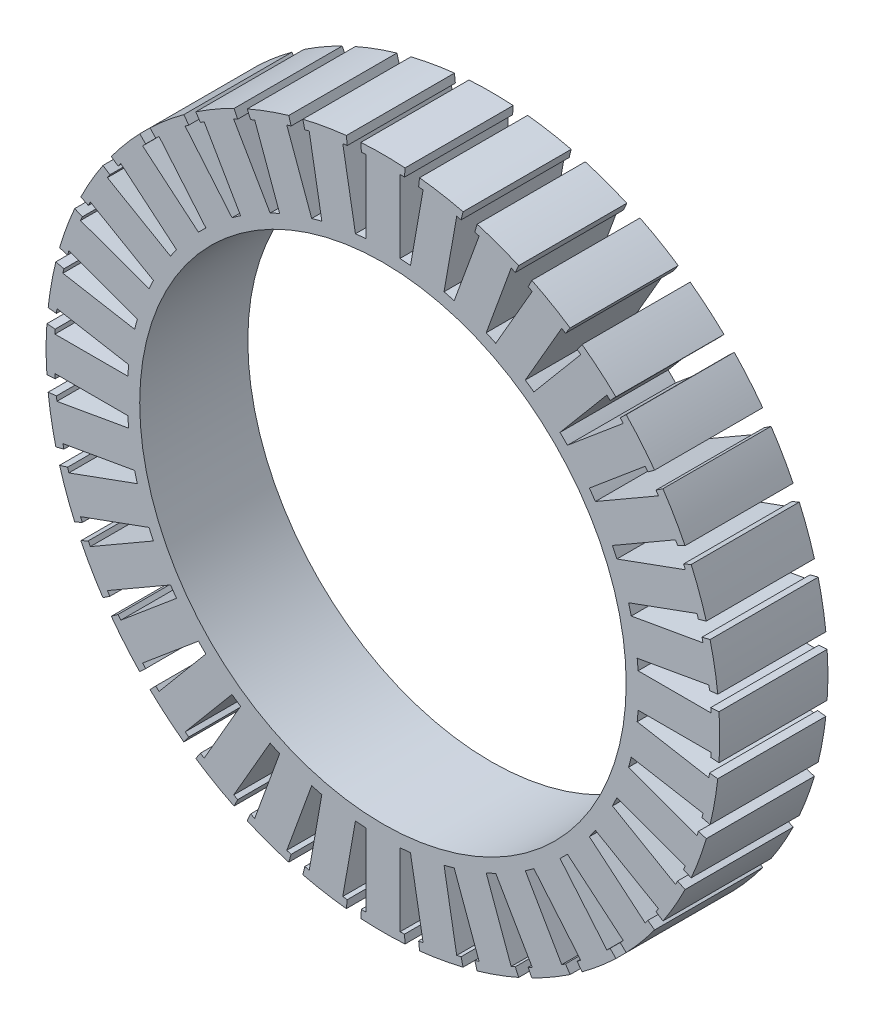
from build123d import *
from build123d.topology import SkipClean

# Parameters (mm, degrees)
BOSS_EXTRUDE2_DEPTH    = 6.5
BOSS_EXTRUDE2_2_DEPTH  = 6.5
BOSS_EXTRUDE2_3_DEPTH  = 6.5
BOSS_EXTRUDE2_4_DEPTH  = 6.5
BOSS_EXTRUDE2_5_DEPTH  = 6.5
BOSS_EXTRUDE2_6_DEPTH  = 6.5
BOSS_EXTRUDE2_7_DEPTH  = 6.5
BOSS_EXTRUDE2_8_DEPTH  = 6.5
BOSS_EXTRUDE2_9_DEPTH  = 6.5
BOSS_EXTRUDE2_10_DEPTH = 6.5
BOSS_EXTRUDE2_11_DEPTH = 6.5
BOSS_EXTRUDE2_12_DEPTH = 6.5
BOSS_EXTRUDE2_13_DEPTH = 6.5
BOSS_EXTRUDE2_14_DEPTH = 6.5
BOSS_EXTRUDE2_15_DEPTH = 6.5
BOSS_EXTRUDE2_16_DEPTH = 6.5
BOSS_EXTRUDE2_17_DEPTH = 6.5
BOSS_EXTRUDE2_18_DEPTH = 6.5
BOSS_EXTRUDE2_19_DEPTH = 6.5
BOSS_EXTRUDE2_20_DEPTH = 6.5
BOSS_EXTRUDE2_21_DEPTH = 6.5
BOSS_EXTRUDE2_22_DEPTH = 6.5
BOSS_EXTRUDE2_23_DEPTH = 6.5
BOSS_EXTRUDE2_24_DEPTH = 6.5
BOSS_EXTRUDE2_25_DEPTH = 6.5
BOSS_EXTRUDE2_26_DEPTH = 6.5
BOSS_EXTRUDE2_27_DEPTH = 6.5
BOSS_EXTRUDE2_28_DEPTH = 6.5
BOSS_EXTRUDE2_29_DEPTH = 6.5
BOSS_EXTRUDE2_30_DEPTH = 6.5
BOSS_EXTRUDE2_31_DEPTH = 6.5
BOSS_EXTRUDE2_32_DEPTH = 6.5
BOSS_EXTRUDE2_33_DEPTH = 6.5
BOSS_EXTRUDE2_34_DEPTH = 6.5
BOSS_EXTRUDE2_35_DEPTH = 6.5
BOSS_EXTRUDE2_36_DEPTH = 6.5
SKETCH2_R              = 30.75
SKETCH2_R_2            = 29.25
BOSS_EXTRUDE3_DEPTH    = 6.5


with BuildPart() as part:
    # Sketch1 → Boss-Extrude2 (new, symmetric)
    with BuildSketch(Plane.XY):
        with BuildLine():
            Line((-2.050835639, 39.446724492), (-2.050835639, 29.178015237))
            ThreePointArc((-2.050835639, 29.178015237), (0, 29.25), (2.050835639, 29.178015237))
            Line((2.050835639, 29.178015237), (2.050835639, 39.446724492))
            ThreePointArc((2.050835639, 39.446724492), (2.321322732, 39.431731648), (2.59170064, 39.41488409))
            Line((2.59170064, 39.41488409), (2.657313314, 40.412729256))
            ThreePointArc((2.657313314, 40.412729256), (0, 40.5), (-2.657313314, 40.412729256))
            Line((-2.657313314, 40.412729256), (-2.59170064, 39.41488409))
            ThreePointArc((-2.59170064, 39.41488409), (-2.321322732, 39.431731648), (-2.050835639, 39.446724492))
        make_face()
    extrude(amount=BOSS_EXTRUDE2_DEPTH, both=True)



with BuildPart() as body_2:
    # Sketch1 → Boss-Extrude2 2 (new, symmetric)
    with BuildSketch(Plane.XY):
        with BuildLine():
            Line((9.634539544, 39.337331478), (9.396649679, 38.366039342))
            ThreePointArc((9.396649679, 38.366039342), (9.133304967, 38.42958158), (8.86953066, 38.49131624))
            Line((8.86953066, 38.49131624), (7.086388011, 28.378611752))
            ThreePointArc((7.086388011, 28.378611752), (5.079209197, 28.805626776), (3.047030337, 29.090859494))
            Line((3.047030337, 29.090859494), (4.830172986, 39.203563982))
            ThreePointArc((4.830172986, 39.203563982), (4.561191719, 39.235768504), (4.291995912, 39.266127529))
            Line((4.291995912, 39.266127529), (4.400654036, 40.260206707))
            ThreePointArc((4.400654036, 40.260206707), (7.032751196, 39.884713997), (9.634539544, 39.337331478))
        make_face()
    extrude(amount=BOSS_EXTRUDE2_2_DEPTH, both=True)


with BuildPart() as body_3:
    # Sketch1 → Boss-Extrude2 3 (new, symmetric)
    with BuildSketch(Plane.XY):
        with BuildLine():
            Line((16.319025165, 37.066688787), (15.916086272, 36.151461904))
            ThreePointArc((15.916086272, 36.151461904), (15.667776352, 36.259768121), (15.418729481, 36.366368821))
            Line((15.418729481, 36.366368821), (11.906624069, 26.716938509))
            ThreePointArc((11.906624069, 26.716938509), (10.004089192, 27.486009158), (8.052313837, 28.119792707))
            Line((8.052313837, 28.119792707), (11.564419249, 37.769223019))
            ThreePointArc((11.564419249, 37.769223019), (11.305116668, 37.847646388), (11.045282339, 37.924289552))
            Line((11.045282339, 37.924289552), (11.32490974, 38.884398149))
            ThreePointArc((11.32490974, 38.884398149), (13.851815805, 38.057551142), (16.319025165, 37.066688787))
        make_face()
    extrude(amount=BOSS_EXTRUDE2_3_DEPTH, both=True)


with BuildPart() as body_4:
    # Sketch1 → Boss-Extrude2 4 (new, symmetric)
    with BuildSketch(Plane.XY):
        with BuildLine():
            Line((22.507665464, 33.669793515), (21.951920638, 32.838440589))
            ThreePointArc((21.951920638, 32.838440589), (21.726190281, 32.988219956), (21.499438008, 33.136447687))
            Line((21.499438008, 33.136447687), (16.365083381, 24.243484608))
            ThreePointArc((16.365083381, 24.243484608), (14.625, 25.331243061), (12.812931857, 26.294320247))
            Line((12.812931857, 26.294320247), (17.947286484, 35.187283326))
            ThreePointArc((17.947286484, 35.187283326), (17.705541368, 35.309542689), (17.462963452, 35.430141229))
            Line((17.462963452, 35.430141229), (17.905063792, 36.327106829))
            ThreePointArc((17.905063792, 36.327106829), (20.25, 35.074028853), (22.507665464, 33.669793515))
        make_face()
    extrude(amount=BOSS_EXTRUDE2_4_DEPTH, both=True)


with BuildPart() as body_5:
    # Sketch1 → Boss-Extrude2 5 (new, symmetric)
    with BuildSketch(Plane.XY):
        with BuildLine():
            Line((28.012421738, 29.249858605), (27.320757003, 28.527639874))
            ThreePointArc((27.320757003, 28.527639874), (27.124464912, 28.714341421), (26.926896991, 28.899692359))
            Line((26.926896991, 28.899692359), (20.326297914, 21.033404696))
            ThreePointArc((20.326297914, 21.033404696), (18.801537583, 22.406799961), (17.184235425, 23.669908172))
            Line((17.184235425, 23.669908172), (23.784834502, 31.536195835))
            ThreePointArc((23.784834502, 31.536195835), (23.567992152, 31.698576402), (23.350041257, 31.859465992))
            Line((23.350041257, 31.859465992), (23.941181542, 32.666034752))
            ThreePointArc((23.941181542, 32.666034752), (26.032898192, 31.024799946), (28.012421738, 29.249858605))
        make_face()
    extrude(amount=BOSS_EXTRUDE2_5_DEPTH, both=True)


with BuildPart() as body_6:
    # Sketch1 → Boss-Extrude2 6 (new, symmetric)
    with BuildSketch(Plane.XY):
        with BuildLine():
            Line((32.666034752, 23.941181542), (31.859465992, 23.350041257))
            ThreePointArc((31.859465992, 23.350041257), (31.698576402, 23.567992152), (31.536195835, 23.784834502))
            Line((31.536195835, 23.784834502), (23.669908172, 17.184235425))
            ThreePointArc((23.669908172, 17.184235425), (22.406799961, 18.801537583), (21.033404696, 20.326297914))
            Line((21.033404696, 20.326297914), (28.899692359, 26.926896991))
            ThreePointArc((28.899692359, 26.926896991), (28.714341421, 27.124464912), (28.527639874, 27.320757003))
            Line((28.527639874, 27.320757003), (29.249858605, 28.012421738))
            ThreePointArc((29.249858605, 28.012421738), (31.024799946, 26.032898192), (32.666034752, 23.941181542))
        make_face()
    extrude(amount=BOSS_EXTRUDE2_6_DEPTH, both=True)


with BuildPart() as body_7:
    # Sketch1 → Boss-Extrude2 7 (new, symmetric)
    with BuildSketch(Plane.XY):
        with BuildLine():
            Line((36.327106829, 17.905063792), (35.430141229, 17.462963452))
            ThreePointArc((35.430141229, 17.462963452), (35.309542689, 17.705541368), (35.187283326, 17.947286484))
            Line((35.187283326, 17.947286484), (26.294320247, 12.812931857))
            ThreePointArc((26.294320247, 12.812931857), (25.331243061, 14.625), (24.243484608, 16.365083381))
            Line((24.243484608, 16.365083381), (33.136447687, 21.499438008))
            ThreePointArc((33.136447687, 21.499438008), (32.988219956, 21.726190281), (32.838440589, 21.951920638))
            Line((32.838440589, 21.951920638), (33.669793515, 22.507665464))
            ThreePointArc((33.669793515, 22.507665464), (35.074028853, 20.25), (36.327106829, 17.905063792))
        make_face()
    extrude(amount=BOSS_EXTRUDE2_7_DEPTH, both=True)


with BuildPart() as body_8:
    # Sketch1 → Boss-Extrude2 8 (new, symmetric)
    with BuildSketch(Plane.XY):
        with BuildLine():
            Line((38.884398149, 11.32490974), (37.924289552, 11.045282339))
            ThreePointArc((37.924289552, 11.045282339), (37.847646388, 11.305116668), (37.769223019, 11.564419249))
            Line((37.769223019, 11.564419249), (28.119792707, 8.052313837))
            ThreePointArc((28.119792707, 8.052313837), (27.486009158, 10.004089192), (26.716938509, 11.906624069))
            Line((26.716938509, 11.906624069), (36.366368821, 15.418729481))
            ThreePointArc((36.366368821, 15.418729481), (36.259768121, 15.667776352), (36.151461904, 15.916086272))
            Line((36.151461904, 15.916086272), (37.066688787, 16.319025165))
            ThreePointArc((37.066688787, 16.319025165), (38.057551142, 13.851815805), (38.884398149, 11.32490974))
        make_face()
    extrude(amount=BOSS_EXTRUDE2_8_DEPTH, both=True)


with BuildPart() as body_9:
    # Sketch1 → Boss-Extrude2 9 (new, symmetric)
    with BuildSketch(Plane.XY):
        with BuildLine():
            Line((40.260206707, 4.400654036), (39.266127529, 4.291995912))
            ThreePointArc((39.266127529, 4.291995912), (39.235768504, 4.561191719), (39.203563982, 4.830172986))
            Line((39.203563982, 4.830172986), (29.090859494, 3.047030337))
            ThreePointArc((29.090859494, 3.047030337), (28.805626776, 5.079209197), (28.378611752, 7.086388011))
            Line((28.378611752, 7.086388011), (38.49131624, 8.86953066))
            ThreePointArc((38.49131624, 8.86953066), (38.42958158, 9.133304967), (38.366039342, 9.396649679))
            Line((38.366039342, 9.396649679), (39.337331478, 9.634539544))
            ThreePointArc((39.337331478, 9.634539544), (39.884713997, 7.032751196), (40.260206707, 4.400654036))
        make_face()
    extrude(amount=BOSS_EXTRUDE2_9_DEPTH, both=True)


with BuildPart() as body_10:
    # Sketch1 → Boss-Extrude2 10 (new, symmetric)
    with BuildSketch(Plane.XY):
        with BuildLine():
            Line((40.412729256, -2.657313314), (39.41488409, -2.59170064))
            ThreePointArc((39.41488409, -2.59170064), (39.431731648, -2.321322732), (39.446724492, -2.050835639))
            Line((39.446724492, -2.050835639), (29.178015237, -2.050835639))
            ThreePointArc((29.178015237, -2.050835639), (29.25, 0), (29.178015237, 2.050835639))
            Line((29.178015237, 2.050835639), (39.446724492, 2.050835639))
            ThreePointArc((39.446724492, 2.050835639), (39.431731648, 2.321322732), (39.41488409, 2.59170064))
            Line((39.41488409, 2.59170064), (40.412729256, 2.657313314))
            ThreePointArc((40.412729256, 2.657313314), (40.5, 0), (40.412729256, -2.657313314))
        make_face()
    extrude(amount=BOSS_EXTRUDE2_10_DEPTH, both=True)


with BuildPart() as body_11:
    # Sketch1 → Boss-Extrude2 11 (new, symmetric)
    with BuildSketch(Plane.XY):
        with BuildLine():
            Line((39.337331478, -9.634539544), (38.366039342, -9.396649679))
            ThreePointArc((38.366039342, -9.396649679), (38.42958158, -9.133304967), (38.49131624, -8.86953066))
            Line((38.49131624, -8.86953066), (28.378611752, -7.086388011))
            ThreePointArc((28.378611752, -7.086388011), (28.805626776, -5.079209197), (29.090859494, -3.047030337))
            Line((29.090859494, -3.047030337), (39.203563982, -4.830172986))
            ThreePointArc((39.203563982, -4.830172986), (39.235768504, -4.561191719), (39.266127529, -4.291995912))
            Line((39.266127529, -4.291995912), (40.260206707, -4.400654036))
            ThreePointArc((40.260206707, -4.400654036), (39.884713997, -7.032751196), (39.337331478, -9.634539544))
        make_face()
    extrude(amount=BOSS_EXTRUDE2_11_DEPTH, both=True)


with BuildPart() as body_12:
    # Sketch1 → Boss-Extrude2 12 (new, symmetric)
    with BuildSketch(Plane.XY):
        with BuildLine():
            Line((37.066688787, -16.319025165), (36.151461904, -15.916086272))
            ThreePointArc((36.151461904, -15.916086272), (36.259768121, -15.667776352), (36.366368821, -15.418729481))
            Line((36.366368821, -15.418729481), (26.716938509, -11.906624069))
            ThreePointArc((26.716938509, -11.906624069), (27.486009158, -10.004089192), (28.119792707, -8.052313837))
            Line((28.119792707, -8.052313837), (37.769223019, -11.564419249))
            ThreePointArc((37.769223019, -11.564419249), (37.847646388, -11.305116668), (37.924289552, -11.045282339))
            Line((37.924289552, -11.045282339), (38.884398149, -11.32490974))
            ThreePointArc((38.884398149, -11.32490974), (38.057551142, -13.851815805), (37.066688787, -16.319025165))
        make_face()
    extrude(amount=BOSS_EXTRUDE2_12_DEPTH, both=True)


with BuildPart() as body_13:
    # Sketch1 → Boss-Extrude2 13 (new, symmetric)
    with BuildSketch(Plane.XY):
        with BuildLine():
            Line((33.669793515, -22.507665464), (32.838440589, -21.951920638))
            ThreePointArc((32.838440589, -21.951920638), (32.988219956, -21.726190281), (33.136447687, -21.499438008))
            Line((33.136447687, -21.499438008), (24.243484608, -16.365083381))
            ThreePointArc((24.243484608, -16.365083381), (25.331243061, -14.625), (26.294320247, -12.812931857))
            Line((26.294320247, -12.812931857), (35.187283326, -17.947286484))
            ThreePointArc((35.187283326, -17.947286484), (35.309542689, -17.705541368), (35.430141229, -17.462963452))
            Line((35.430141229, -17.462963452), (36.327106829, -17.905063792))
            ThreePointArc((36.327106829, -17.905063792), (35.074028853, -20.25), (33.669793515, -22.507665464))
        make_face()
    extrude(amount=BOSS_EXTRUDE2_13_DEPTH, both=True)


with BuildPart() as body_14:
    # Sketch1 → Boss-Extrude2 14 (new, symmetric)
    with BuildSketch(Plane.XY):
        with BuildLine():
            Line((29.249858605, -28.012421738), (28.527639874, -27.320757003))
            ThreePointArc((28.527639874, -27.320757003), (28.714341421, -27.124464912), (28.899692359, -26.926896991))
            Line((28.899692359, -26.926896991), (21.033404696, -20.326297914))
            ThreePointArc((21.033404696, -20.326297914), (22.406799961, -18.801537583), (23.669908172, -17.184235425))
            Line((23.669908172, -17.184235425), (31.536195835, -23.784834502))
            ThreePointArc((31.536195835, -23.784834502), (31.698576402, -23.567992152), (31.859465992, -23.350041257))
            Line((31.859465992, -23.350041257), (32.666034752, -23.941181542))
            ThreePointArc((32.666034752, -23.941181542), (31.024799946, -26.032898192), (29.249858605, -28.012421738))
        make_face()
    extrude(amount=BOSS_EXTRUDE2_14_DEPTH, both=True)


with BuildPart() as body_15:
    # Sketch1 → Boss-Extrude2 15 (new, symmetric)
    with BuildSketch(Plane.XY):
        with BuildLine():
            Line((23.941181542, -32.666034752), (23.350041257, -31.859465992))
            ThreePointArc((23.350041257, -31.859465992), (23.567992152, -31.698576402), (23.784834502, -31.536195835))
            Line((23.784834502, -31.536195835), (17.184235425, -23.669908172))
            ThreePointArc((17.184235425, -23.669908172), (18.801537583, -22.406799961), (20.326297914, -21.033404696))
            Line((20.326297914, -21.033404696), (26.926896991, -28.899692359))
            ThreePointArc((26.926896991, -28.899692359), (27.124464912, -28.714341421), (27.320757003, -28.527639874))
            Line((27.320757003, -28.527639874), (28.012421738, -29.249858605))
            ThreePointArc((28.012421738, -29.249858605), (26.032898192, -31.024799946), (23.941181542, -32.666034752))
        make_face()
    extrude(amount=BOSS_EXTRUDE2_15_DEPTH, both=True)


with BuildPart() as body_16:
    # Sketch1 → Boss-Extrude2 16 (new, symmetric)
    with BuildSketch(Plane.XY):
        with BuildLine():
            Line((17.905063792, -36.327106829), (17.462963452, -35.430141229))
            ThreePointArc((17.462963452, -35.430141229), (17.705541368, -35.309542689), (17.947286484, -35.187283326))
            Line((17.947286484, -35.187283326), (12.812931857, -26.294320247))
            ThreePointArc((12.812931857, -26.294320247), (14.625, -25.331243061), (16.365083381, -24.243484608))
            Line((16.365083381, -24.243484608), (21.499438008, -33.136447687))
            ThreePointArc((21.499438008, -33.136447687), (21.726190281, -32.988219956), (21.951920638, -32.838440589))
            Line((21.951920638, -32.838440589), (22.507665464, -33.669793515))
            ThreePointArc((22.507665464, -33.669793515), (20.25, -35.074028853), (17.905063792, -36.327106829))
        make_face()
    extrude(amount=BOSS_EXTRUDE2_16_DEPTH, both=True)


with BuildPart() as body_17:
    # Sketch1 → Boss-Extrude2 17 (new, symmetric)
    with BuildSketch(Plane.XY):
        with BuildLine():
            Line((11.32490974, -38.884398149), (11.045282339, -37.924289552))
            ThreePointArc((11.045282339, -37.924289552), (11.305116668, -37.847646388), (11.564419249, -37.769223019))
            Line((11.564419249, -37.769223019), (8.052313837, -28.119792707))
            ThreePointArc((8.052313837, -28.119792707), (10.004089192, -27.486009158), (11.906624069, -26.716938509))
            Line((11.906624069, -26.716938509), (15.418729481, -36.366368821))
            ThreePointArc((15.418729481, -36.366368821), (15.667776352, -36.259768121), (15.916086272, -36.151461904))
            Line((15.916086272, -36.151461904), (16.319025165, -37.066688787))
            ThreePointArc((16.319025165, -37.066688787), (13.851815805, -38.057551142), (11.32490974, -38.884398149))
        make_face()
    extrude(amount=BOSS_EXTRUDE2_17_DEPTH, both=True)


with BuildPart() as body_18:
    # Sketch1 → Boss-Extrude2 18 (new, symmetric)
    with BuildSketch(Plane.XY):
        with BuildLine():
            Line((4.400654036, -40.260206707), (4.291995912, -39.266127529))
            ThreePointArc((4.291995912, -39.266127529), (4.561191719, -39.235768504), (4.830172986, -39.203563982))
            Line((4.830172986, -39.203563982), (3.047030337, -29.090859494))
            ThreePointArc((3.047030337, -29.090859494), (5.079209197, -28.805626776), (7.086388011, -28.378611752))
            Line((7.086388011, -28.378611752), (8.86953066, -38.49131624))
            ThreePointArc((8.86953066, -38.49131624), (9.133304967, -38.42958158), (9.396649679, -38.366039342))
            Line((9.396649679, -38.366039342), (9.634539544, -39.337331478))
            ThreePointArc((9.634539544, -39.337331478), (7.032751196, -39.884713997), (4.400654036, -40.260206707))
        make_face()
    extrude(amount=BOSS_EXTRUDE2_18_DEPTH, both=True)


with BuildPart() as body_19:
    # Sketch1 → Boss-Extrude2 19 (new, symmetric)
    with BuildSketch(Plane.XY):
        with BuildLine():
            Line((-2.657313314, -40.412729256), (-2.59170064, -39.41488409))
            ThreePointArc((-2.59170064, -39.41488409), (-2.321322732, -39.431731648), (-2.050835639, -39.446724492))
            Line((-2.050835639, -39.446724492), (-2.050835639, -29.178015237))
            ThreePointArc((-2.050835639, -29.178015237), (0, -29.25), (2.050835639, -29.178015237))
            Line((2.050835639, -29.178015237), (2.050835639, -39.446724492))
            ThreePointArc((2.050835639, -39.446724492), (2.321322732, -39.431731648), (2.59170064, -39.41488409))
            Line((2.59170064, -39.41488409), (2.657313314, -40.412729256))
            ThreePointArc((2.657313314, -40.412729256), (0, -40.5), (-2.657313314, -40.412729256))
        make_face()
    extrude(amount=BOSS_EXTRUDE2_19_DEPTH, both=True)


with BuildPart() as body_20:
    # Sketch1 → Boss-Extrude2 20 (new, symmetric)
    with BuildSketch(Plane.XY):
        with BuildLine():
            Line((-9.634539544, -39.337331478), (-9.396649679, -38.366039342))
            ThreePointArc((-9.396649679, -38.366039342), (-9.133304967, -38.42958158), (-8.86953066, -38.49131624))
            Line((-8.86953066, -38.49131624), (-7.086388011, -28.378611752))
            ThreePointArc((-7.086388011, -28.378611752), (-5.079209197, -28.805626776), (-3.047030337, -29.090859494))
            Line((-3.047030337, -29.090859494), (-4.830172986, -39.203563982))
            ThreePointArc((-4.830172986, -39.203563982), (-4.561191719, -39.235768504), (-4.291995912, -39.266127529))
            Line((-4.291995912, -39.266127529), (-4.400654036, -40.260206707))
            ThreePointArc((-4.400654036, -40.260206707), (-7.032751196, -39.884713997), (-9.634539544, -39.337331478))
        make_face()
    extrude(amount=BOSS_EXTRUDE2_20_DEPTH, both=True)


with BuildPart() as body_21:
    # Sketch1 → Boss-Extrude2 21 (new, symmetric)
    with BuildSketch(Plane.XY):
        with BuildLine():
            Line((-16.319025165, -37.066688787), (-15.916086272, -36.151461904))
            ThreePointArc((-15.916086272, -36.151461904), (-15.667776352, -36.259768121), (-15.418729481, -36.366368821))
            Line((-15.418729481, -36.366368821), (-11.906624069, -26.716938509))
            ThreePointArc((-11.906624069, -26.716938509), (-10.004089192, -27.486009158), (-8.052313837, -28.119792707))
            Line((-8.052313837, -28.119792707), (-11.564419249, -37.769223019))
            ThreePointArc((-11.564419249, -37.769223019), (-11.305116668, -37.847646388), (-11.045282339, -37.924289552))
            Line((-11.045282339, -37.924289552), (-11.32490974, -38.884398149))
            ThreePointArc((-11.32490974, -38.884398149), (-13.851815805, -38.057551142), (-16.319025165, -37.066688787))
        make_face()
    extrude(amount=BOSS_EXTRUDE2_21_DEPTH, both=True)


with BuildPart() as body_22:
    # Sketch1 → Boss-Extrude2 22 (new, symmetric)
    with BuildSketch(Plane.XY):
        with BuildLine():
            Line((-22.507665464, -33.669793515), (-21.951920638, -32.838440589))
            ThreePointArc((-21.951920638, -32.838440589), (-21.726190281, -32.988219956), (-21.499438008, -33.136447687))
            Line((-21.499438008, -33.136447687), (-16.365083381, -24.243484608))
            ThreePointArc((-16.365083381, -24.243484608), (-14.625, -25.331243061), (-12.812931857, -26.294320247))
            Line((-12.812931857, -26.294320247), (-17.947286484, -35.187283326))
            ThreePointArc((-17.947286484, -35.187283326), (-17.705541368, -35.309542689), (-17.462963452, -35.430141229))
            Line((-17.462963452, -35.430141229), (-17.905063792, -36.327106829))
            ThreePointArc((-17.905063792, -36.327106829), (-20.25, -35.074028853), (-22.507665464, -33.669793515))
        make_face()
    extrude(amount=BOSS_EXTRUDE2_22_DEPTH, both=True)


with BuildPart() as body_23:
    # Sketch1 → Boss-Extrude2 23 (new, symmetric)
    with BuildSketch(Plane.XY):
        with BuildLine():
            Line((-28.012421738, -29.249858605), (-27.320757003, -28.527639874))
            ThreePointArc((-27.320757003, -28.527639874), (-27.124464912, -28.714341421), (-26.926896991, -28.899692359))
            Line((-26.926896991, -28.899692359), (-20.326297914, -21.033404696))
            ThreePointArc((-20.326297914, -21.033404696), (-18.801537583, -22.406799961), (-17.184235425, -23.669908172))
            Line((-17.184235425, -23.669908172), (-23.784834502, -31.536195835))
            ThreePointArc((-23.784834502, -31.536195835), (-23.567992152, -31.698576402), (-23.350041257, -31.859465992))
            Line((-23.350041257, -31.859465992), (-23.941181542, -32.666034752))
            ThreePointArc((-23.941181542, -32.666034752), (-26.032898192, -31.024799946), (-28.012421738, -29.249858605))
        make_face()
    extrude(amount=BOSS_EXTRUDE2_23_DEPTH, both=True)


with BuildPart() as body_24:
    # Sketch1 → Boss-Extrude2 24 (new, symmetric)
    with BuildSketch(Plane.XY):
        with BuildLine():
            Line((-32.666034752, -23.941181542), (-31.859465992, -23.350041257))
            ThreePointArc((-31.859465992, -23.350041257), (-31.698576402, -23.567992152), (-31.536195835, -23.784834502))
            Line((-31.536195835, -23.784834502), (-23.669908172, -17.184235425))
            ThreePointArc((-23.669908172, -17.184235425), (-22.406799961, -18.801537583), (-21.033404696, -20.326297914))
            Line((-21.033404696, -20.326297914), (-28.899692359, -26.926896991))
            ThreePointArc((-28.899692359, -26.926896991), (-28.714341421, -27.124464912), (-28.527639874, -27.320757003))
            Line((-28.527639874, -27.320757003), (-29.249858605, -28.012421738))
            ThreePointArc((-29.249858605, -28.012421738), (-31.024799946, -26.032898192), (-32.666034752, -23.941181542))
        make_face()
    extrude(amount=BOSS_EXTRUDE2_24_DEPTH, both=True)


with BuildPart() as body_25:
    # Sketch1 → Boss-Extrude2 25 (new, symmetric)
    with BuildSketch(Plane.XY):
        with BuildLine():
            Line((-36.327106829, -17.905063792), (-35.430141229, -17.462963452))
            ThreePointArc((-35.430141229, -17.462963452), (-35.309542689, -17.705541368), (-35.187283326, -17.947286484))
            Line((-35.187283326, -17.947286484), (-26.294320247, -12.812931857))
            ThreePointArc((-26.294320247, -12.812931857), (-25.331243061, -14.625), (-24.243484608, -16.365083381))
            Line((-24.243484608, -16.365083381), (-33.136447687, -21.499438008))
            ThreePointArc((-33.136447687, -21.499438008), (-32.988219956, -21.726190281), (-32.838440589, -21.951920638))
            Line((-32.838440589, -21.951920638), (-33.669793515, -22.507665464))
            ThreePointArc((-33.669793515, -22.507665464), (-35.074028853, -20.25), (-36.327106829, -17.905063792))
        make_face()
    extrude(amount=BOSS_EXTRUDE2_25_DEPTH, both=True)


with BuildPart() as body_26:
    # Sketch1 → Boss-Extrude2 26 (new, symmetric)
    with BuildSketch(Plane.XY):
        with BuildLine():
            Line((-38.884398149, -11.32490974), (-37.924289552, -11.045282339))
            ThreePointArc((-37.924289552, -11.045282339), (-37.847646388, -11.305116668), (-37.769223019, -11.564419249))
            Line((-37.769223019, -11.564419249), (-28.119792707, -8.052313837))
            ThreePointArc((-28.119792707, -8.052313837), (-27.486009158, -10.004089192), (-26.716938509, -11.906624069))
            Line((-26.716938509, -11.906624069), (-36.366368821, -15.418729481))
            ThreePointArc((-36.366368821, -15.418729481), (-36.259768121, -15.667776352), (-36.151461904, -15.916086272))
            Line((-36.151461904, -15.916086272), (-37.066688787, -16.319025165))
            ThreePointArc((-37.066688787, -16.319025165), (-38.057551142, -13.851815805), (-38.884398149, -11.32490974))
        make_face()
    extrude(amount=BOSS_EXTRUDE2_26_DEPTH, both=True)


with BuildPart() as body_27:
    # Sketch1 → Boss-Extrude2 27 (new, symmetric)
    with BuildSketch(Plane.XY):
        with BuildLine():
            Line((-40.260206707, -4.400654036), (-39.266127529, -4.291995912))
            ThreePointArc((-39.266127529, -4.291995912), (-39.235768504, -4.561191719), (-39.203563982, -4.830172986))
            Line((-39.203563982, -4.830172986), (-29.090859494, -3.047030337))
            ThreePointArc((-29.090859494, -3.047030337), (-28.805626776, -5.079209197), (-28.378611752, -7.086388011))
            Line((-28.378611752, -7.086388011), (-38.49131624, -8.86953066))
            ThreePointArc((-38.49131624, -8.86953066), (-38.42958158, -9.133304967), (-38.366039342, -9.396649679))
            Line((-38.366039342, -9.396649679), (-39.337331478, -9.634539544))
            ThreePointArc((-39.337331478, -9.634539544), (-39.884713997, -7.032751196), (-40.260206707, -4.400654036))
        make_face()
    extrude(amount=BOSS_EXTRUDE2_27_DEPTH, both=True)


with BuildPart() as body_28:
    # Sketch1 → Boss-Extrude2 28 (new, symmetric)
    with BuildSketch(Plane.XY):
        with BuildLine():
            Line((-40.412729256, 2.657313314), (-39.41488409, 2.59170064))
            ThreePointArc((-39.41488409, 2.59170064), (-39.431731648, 2.321322732), (-39.446724492, 2.050835639))
            Line((-39.446724492, 2.050835639), (-29.178015237, 2.050835639))
            ThreePointArc((-29.178015237, 2.050835639), (-29.25, 0), (-29.178015237, -2.050835639))
            Line((-29.178015237, -2.050835639), (-39.446724492, -2.050835639))
            ThreePointArc((-39.446724492, -2.050835639), (-39.431731648, -2.321322732), (-39.41488409, -2.59170064))
            Line((-39.41488409, -2.59170064), (-40.412729256, -2.657313314))
            ThreePointArc((-40.412729256, -2.657313314), (-40.5, 0), (-40.412729256, 2.657313314))
        make_face()
    extrude(amount=BOSS_EXTRUDE2_28_DEPTH, both=True)


with BuildPart() as body_29:
    # Sketch1 → Boss-Extrude2 29 (new, symmetric)
    with BuildSketch(Plane.XY):
        with BuildLine():
            Line((-39.337331478, 9.634539544), (-38.366039342, 9.396649679))
            ThreePointArc((-38.366039342, 9.396649679), (-38.42958158, 9.133304967), (-38.49131624, 8.86953066))
            Line((-38.49131624, 8.86953066), (-28.378611752, 7.086388011))
            ThreePointArc((-28.378611752, 7.086388011), (-28.805626776, 5.079209197), (-29.090859494, 3.047030337))
            Line((-29.090859494, 3.047030337), (-39.203563982, 4.830172986))
            ThreePointArc((-39.203563982, 4.830172986), (-39.235768504, 4.561191719), (-39.266127529, 4.291995912))
            Line((-39.266127529, 4.291995912), (-40.260206707, 4.400654036))
            ThreePointArc((-40.260206707, 4.400654036), (-39.884713997, 7.032751196), (-39.337331478, 9.634539544))
        make_face()
    extrude(amount=BOSS_EXTRUDE2_29_DEPTH, both=True)


with BuildPart() as body_30:
    # Sketch1 → Boss-Extrude2 30 (new, symmetric)
    with BuildSketch(Plane.XY):
        with BuildLine():
            Line((-37.066688787, 16.319025165), (-36.151461904, 15.916086272))
            ThreePointArc((-36.151461904, 15.916086272), (-36.259768121, 15.667776352), (-36.366368821, 15.418729481))
            Line((-36.366368821, 15.418729481), (-26.716938509, 11.906624069))
            ThreePointArc((-26.716938509, 11.906624069), (-27.486009158, 10.004089192), (-28.119792707, 8.052313837))
            Line((-28.119792707, 8.052313837), (-37.769223019, 11.564419249))
            ThreePointArc((-37.769223019, 11.564419249), (-37.847646388, 11.305116668), (-37.924289552, 11.045282339))
            Line((-37.924289552, 11.045282339), (-38.884398149, 11.32490974))
            ThreePointArc((-38.884398149, 11.32490974), (-38.057551142, 13.851815805), (-37.066688787, 16.319025165))
        make_face()
    extrude(amount=BOSS_EXTRUDE2_30_DEPTH, both=True)


with BuildPart() as body_31:
    # Sketch1 → Boss-Extrude2 31 (new, symmetric)
    with BuildSketch(Plane.XY):
        with BuildLine():
            Line((-33.669793515, 22.507665464), (-32.838440589, 21.951920638))
            ThreePointArc((-32.838440589, 21.951920638), (-32.988219956, 21.726190281), (-33.136447687, 21.499438008))
            Line((-33.136447687, 21.499438008), (-24.243484608, 16.365083381))
            ThreePointArc((-24.243484608, 16.365083381), (-25.331243061, 14.625), (-26.294320247, 12.812931857))
            Line((-26.294320247, 12.812931857), (-35.187283326, 17.947286484))
            ThreePointArc((-35.187283326, 17.947286484), (-35.309542689, 17.705541368), (-35.430141229, 17.462963452))
            Line((-35.430141229, 17.462963452), (-36.327106829, 17.905063792))
            ThreePointArc((-36.327106829, 17.905063792), (-35.074028853, 20.25), (-33.669793515, 22.507665464))
        make_face()
    extrude(amount=BOSS_EXTRUDE2_31_DEPTH, both=True)


with BuildPart() as body_32:
    # Sketch1 → Boss-Extrude2 32 (new, symmetric)
    with BuildSketch(Plane.XY):
        with BuildLine():
            Line((-29.249858605, 28.012421738), (-28.527639874, 27.320757003))
            ThreePointArc((-28.527639874, 27.320757003), (-28.714341421, 27.124464912), (-28.899692359, 26.926896991))
            Line((-28.899692359, 26.926896991), (-21.033404696, 20.326297914))
            ThreePointArc((-21.033404696, 20.326297914), (-22.406799961, 18.801537583), (-23.669908172, 17.184235425))
            Line((-23.669908172, 17.184235425), (-31.536195835, 23.784834502))
            ThreePointArc((-31.536195835, 23.784834502), (-31.698576402, 23.567992152), (-31.859465992, 23.350041257))
            Line((-31.859465992, 23.350041257), (-32.666034752, 23.941181542))
            ThreePointArc((-32.666034752, 23.941181542), (-31.024799946, 26.032898192), (-29.249858605, 28.012421738))
        make_face()
    extrude(amount=BOSS_EXTRUDE2_32_DEPTH, both=True)


with BuildPart() as body_33:
    # Sketch1 → Boss-Extrude2 33 (new, symmetric)
    with BuildSketch(Plane.XY):
        with BuildLine():
            Line((-23.941181542, 32.666034752), (-23.350041257, 31.859465992))
            ThreePointArc((-23.350041257, 31.859465992), (-23.567992152, 31.698576402), (-23.784834502, 31.536195835))
            Line((-23.784834502, 31.536195835), (-17.184235425, 23.669908172))
            ThreePointArc((-17.184235425, 23.669908172), (-18.801537583, 22.406799961), (-20.326297914, 21.033404696))
            Line((-20.326297914, 21.033404696), (-26.926896991, 28.899692359))
            ThreePointArc((-26.926896991, 28.899692359), (-27.124464912, 28.714341421), (-27.320757003, 28.527639874))
            Line((-27.320757003, 28.527639874), (-28.012421738, 29.249858605))
            ThreePointArc((-28.012421738, 29.249858605), (-26.032898192, 31.024799946), (-23.941181542, 32.666034752))
        make_face()
    extrude(amount=BOSS_EXTRUDE2_33_DEPTH, both=True)


with BuildPart() as body_34:
    # Sketch1 → Boss-Extrude2 34 (new, symmetric)
    with BuildSketch(Plane.XY):
        with BuildLine():
            Line((-17.905063792, 36.327106829), (-17.462963452, 35.430141229))
            ThreePointArc((-17.462963452, 35.430141229), (-17.705541368, 35.309542689), (-17.947286484, 35.187283326))
            Line((-17.947286484, 35.187283326), (-12.812931857, 26.294320247))
            ThreePointArc((-12.812931857, 26.294320247), (-14.625, 25.331243061), (-16.365083381, 24.243484608))
            Line((-16.365083381, 24.243484608), (-21.499438008, 33.136447687))
            ThreePointArc((-21.499438008, 33.136447687), (-21.726190281, 32.988219956), (-21.951920638, 32.838440589))
            Line((-21.951920638, 32.838440589), (-22.507665464, 33.669793515))
            ThreePointArc((-22.507665464, 33.669793515), (-20.25, 35.074028853), (-17.905063792, 36.327106829))
        make_face()
    extrude(amount=BOSS_EXTRUDE2_34_DEPTH, both=True)


with BuildPart() as body_35:
    # Sketch1 → Boss-Extrude2 35 (new, symmetric)
    with BuildSketch(Plane.XY):
        with BuildLine():
            Line((-11.32490974, 38.884398149), (-11.045282339, 37.924289552))
            ThreePointArc((-11.045282339, 37.924289552), (-11.305116668, 37.847646388), (-11.564419249, 37.769223019))
            Line((-11.564419249, 37.769223019), (-8.052313837, 28.119792707))
            ThreePointArc((-8.052313837, 28.119792707), (-10.004089192, 27.486009158), (-11.906624069, 26.716938509))
            Line((-11.906624069, 26.716938509), (-15.418729481, 36.366368821))
            ThreePointArc((-15.418729481, 36.366368821), (-15.667776352, 36.259768121), (-15.916086272, 36.151461904))
            Line((-15.916086272, 36.151461904), (-16.319025165, 37.066688787))
            ThreePointArc((-16.319025165, 37.066688787), (-13.851815805, 38.057551142), (-11.32490974, 38.884398149))
        make_face()
    extrude(amount=BOSS_EXTRUDE2_35_DEPTH, both=True)


with BuildPart() as body_36:
    # Sketch1 → Boss-Extrude2 36 (new, symmetric)
    with BuildSketch(Plane.XY):
        with BuildLine():
            Line((-4.400654036, 40.260206707), (-4.291995912, 39.266127529))
            ThreePointArc((-4.291995912, 39.266127529), (-4.561191719, 39.235768504), (-4.830172986, 39.203563982))
            Line((-4.830172986, 39.203563982), (-3.047030337, 29.090859494))
            ThreePointArc((-3.047030337, 29.090859494), (-5.079209197, 28.805626776), (-7.086388011, 28.378611752))
            Line((-7.086388011, 28.378611752), (-8.86953066, 38.49131624))
            ThreePointArc((-8.86953066, 38.49131624), (-9.133304967, 38.42958158), (-9.396649679, 38.366039342))
            Line((-9.396649679, 38.366039342), (-9.634539544, 39.337331478))
            ThreePointArc((-9.634539544, 39.337331478), (-7.032751196, 39.884713997), (-4.400654036, 40.260206707))
        make_face()
    extrude(amount=BOSS_EXTRUDE2_36_DEPTH, both=True)


with BuildPart() as part_1:
    with SkipClean():  # the faces are left unmerged after this step: merging them gives an invalid solid
        add(part.part)

        add(body_2.part)  # Boss-Extrude3 merges body 2

        add(body_3.part)  # Boss-Extrude3 merges body 3

        add(body_4.part)  # Boss-Extrude3 merges body 4

        add(body_5.part)  # Boss-Extrude3 merges body 5

        add(body_6.part)  # Boss-Extrude3 merges body 6

        add(body_7.part)  # Boss-Extrude3 merges body 7

        add(body_8.part)  # Boss-Extrude3 merges body 8

        add(body_9.part)  # Boss-Extrude3 merges body 9

        add(body_10.part)  # Boss-Extrude3 merges body 10

        add(body_11.part)  # Boss-Extrude3 merges body 11

        add(body_12.part)  # Boss-Extrude3 merges body 12

        add(body_13.part)  # Boss-Extrude3 merges body 13

        add(body_14.part)  # Boss-Extrude3 merges body 14

        add(body_15.part)  # Boss-Extrude3 merges body 15

        add(body_16.part)  # Boss-Extrude3 merges body 16

        add(body_17.part)  # Boss-Extrude3 merges body 17

        add(body_18.part)  # Boss-Extrude3 merges body 18

        add(body_19.part)  # Boss-Extrude3 merges body 19

        add(body_20.part)  # Boss-Extrude3 merges body 20

        add(body_21.part)  # Boss-Extrude3 merges body 21

        add(body_22.part)  # Boss-Extrude3 merges body 22

        add(body_23.part)  # Boss-Extrude3 merges body 23

        add(body_24.part)  # Boss-Extrude3 merges body 24

        add(body_25.part)  # Boss-Extrude3 merges body 25

        add(body_26.part)  # Boss-Extrude3 merges body 26

        add(body_27.part)  # Boss-Extrude3 merges body 27

        add(body_28.part)  # Boss-Extrude3 merges body 28

        add(body_29.part)  # Boss-Extrude3 merges body 29

        add(body_30.part)  # Boss-Extrude3 merges body 30

        add(body_31.part)  # Boss-Extrude3 merges body 31

        add(body_32.part)  # Boss-Extrude3 merges body 32

        add(body_33.part)  # Boss-Extrude3 merges body 33

        add(body_34.part)  # Boss-Extrude3 merges body 34

        add(body_35.part)  # Boss-Extrude3 merges body 35

        add(body_36.part)  # Boss-Extrude3 merges body 36
        # Sketch2 → Boss-Extrude3 (add, symmetric)
        with BuildSketch(Plane.XY):
            Circle(SKETCH2_R)
            with Locations(Location((0, 0, 0), (0, 0, 180))):
                Circle(SKETCH2_R_2, mode=Mode.SUBTRACT)
        extrude(amount=BOSS_EXTRUDE3_DEPTH, both=True)


solid = part_1.part
